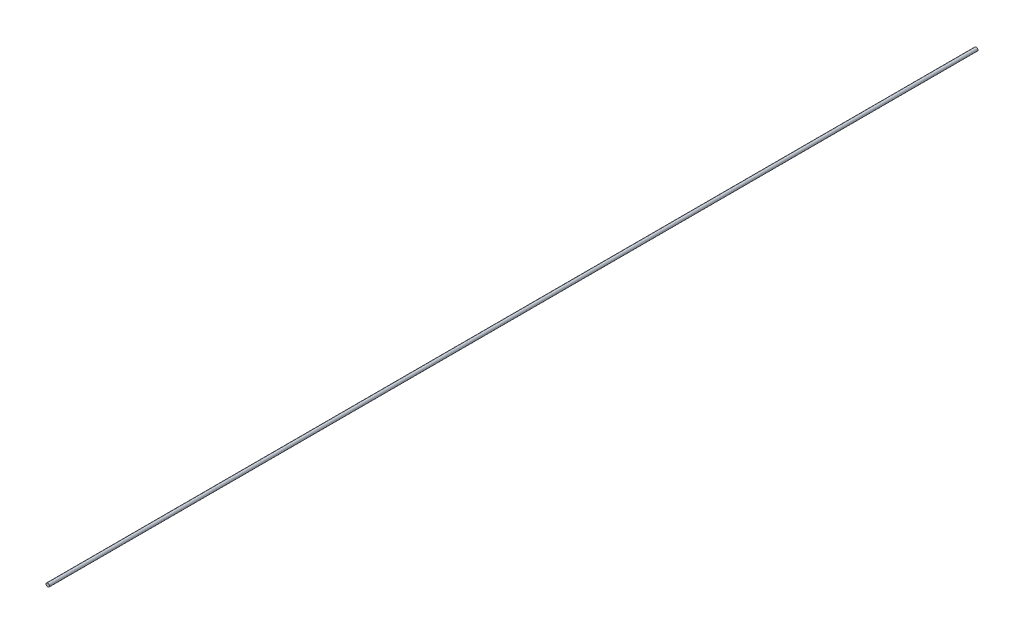
from build123d import *

# Parameters (mm, degrees)
SKETCH_1_R      = 0.2
EXTRUDE_1_DEPTH = 108


with BuildPart() as part:
    # 草图1 → 凸台-拉伸1 (new body)
    with BuildSketch(Plane.XY):
        Circle(SKETCH_1_R)
    extrude(amount=EXTRUDE_1_DEPTH)


solid = part.part
